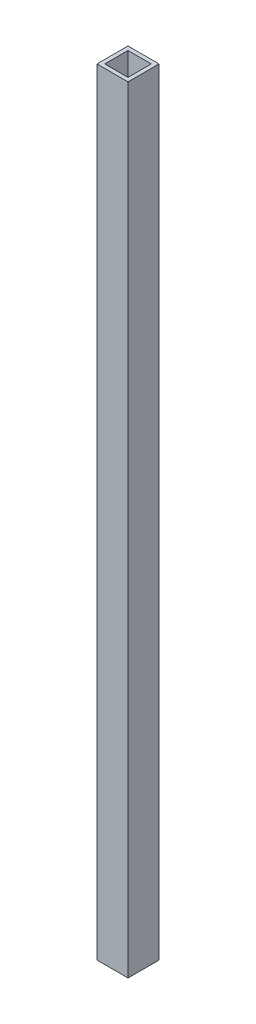
from build123d import *

# Parameters (mm, degrees)
SKETCH1_W           = 2.54
SKETCH1_H           = 2.54
BOSS_EXTRUDE1_DEPTH = 63.5
SKETCH2_W           = 1.905
SKETCH2_H           = 1.905
CUT_EXTRUDE1_DEPTH  = 64.60151885


with BuildPart() as part:
    # Sketch1 → Boss-Extrude1 (new body)
    with BuildSketch(Plane(origin=(0, 0, 0), x_dir=(1, 0, 0), z_dir=(0, 1, 0))):
        with Locations((1.27, 1.27)):
            Rectangle(SKETCH1_W, SKETCH1_H)
    extrude(amount=BOSS_EXTRUDE1_DEPTH)

    # Sketch2 → Cut-Extrude1 (cut, through all)
    with BuildSketch(Plane(origin=(0, 63.5, 0), x_dir=(1, 0, 0), z_dir=(0, 1, 0))):
        with Locations((1.27, 1.27)):
            Rectangle(SKETCH2_W, SKETCH2_H)
    extrude(amount=-CUT_EXTRUDE1_DEPTH, mode=Mode.SUBTRACT)


solid = part.part
